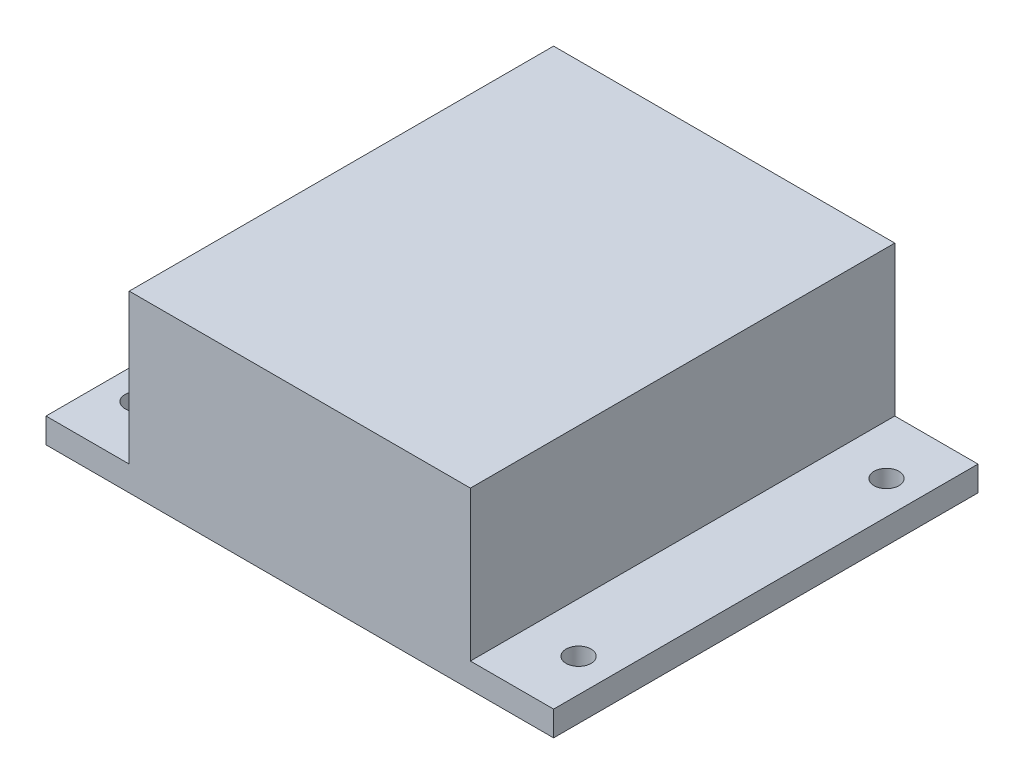
from build123d import *

# Parameters (mm, degrees)
ESBO_O1_W                = 61
ESBO_O1_H                = 51
ESBO_O1_R                = 1.5
RESSALTO_EXTRUS_O1_DEPTH = 21
ESBO_O2_W                = 10
ESBO_O2_H                = 51
CORTE_EXTRUS_O1_DEPTH    = 18


with BuildPart() as part:
    # Esboço1 → Ressalto-extrusão1 (new body)
    with BuildSketch(Plane(origin=(0, 0, 0), x_dir=(1, 0, 0), z_dir=(0, 1, 0))):
        Rectangle(ESBO_O1_W, ESBO_O1_H)
        with Locations(Location((-26.5, 18.5, 0), (0, 0, 90))):
            Circle(ESBO_O1_R, mode=Mode.SUBTRACT)
        with Locations(Location((-26.5, -18.5, 0), (0, 0, 90))):
            Circle(ESBO_O1_R, mode=Mode.SUBTRACT)
        with Locations(Location((26.5, -18.5, 0), (0, 0, 90))):
            Circle(ESBO_O1_R, mode=Mode.SUBTRACT)
        with Locations(Location((26.5, 18.5, 0), (0, 0, 90))):
            Circle(ESBO_O1_R, mode=Mode.SUBTRACT)
    extrude(amount=RESSALTO_EXTRUS_O1_DEPTH)

    # Esboço2 → Corte-extrusão1 (cut)
    with BuildSketch(Plane(origin=(0, 21, 0), x_dir=(1, 0, 0), z_dir=(0, 1, 0))):
        with Locations((-25.5, 0)):
            Rectangle(ESBO_O2_W, ESBO_O2_H)
        with Locations((25.5, 0)):
            Rectangle(ESBO_O2_W, ESBO_O2_H)
    extrude(amount=-CORTE_EXTRUS_O1_DEPTH, mode=Mode.SUBTRACT)


solid = part.part
